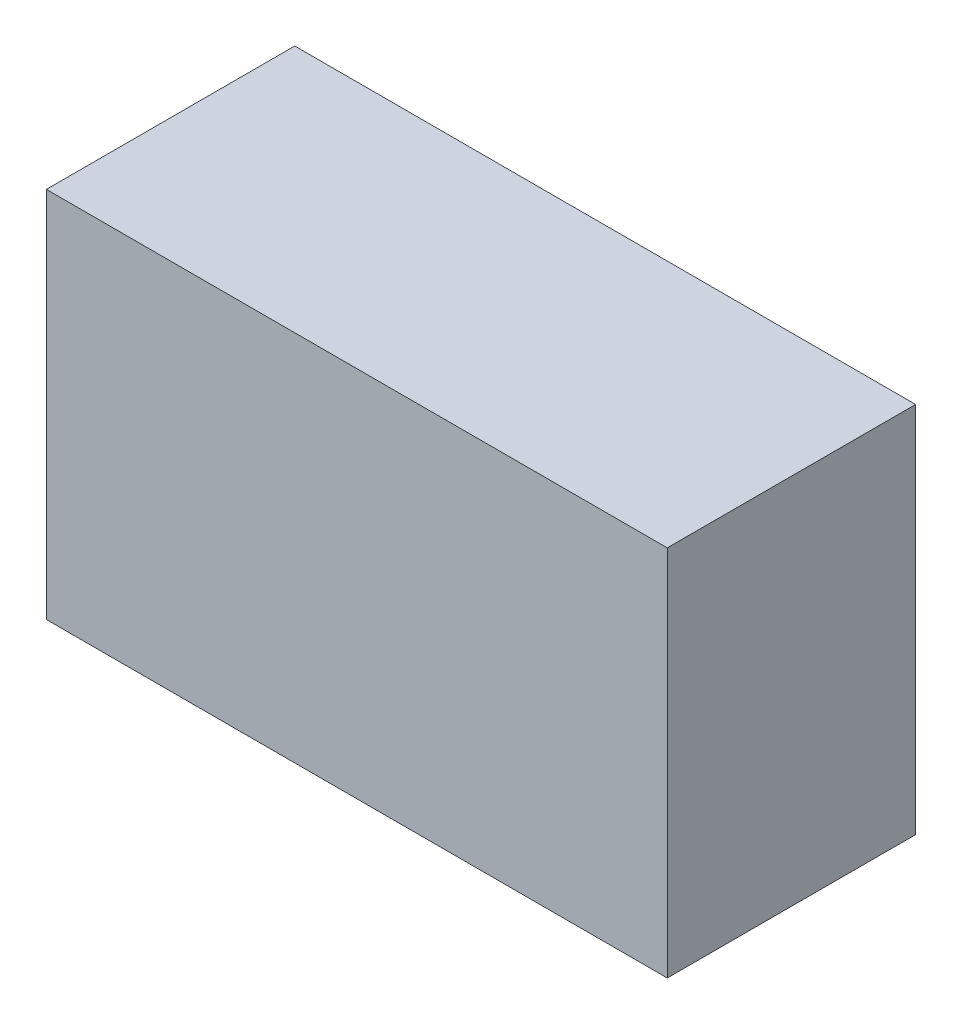
from build123d import *

# Parameters (mm, degrees)
SKETCH_1_W      = 50
SKETCH_1_H      = 30
EXTRUDE_1_DEPTH = 20


with BuildPart() as part:
    # 草图1 → 凸台-拉伸1 (new body)
    with BuildSketch(Plane.XY):
        Rectangle(SKETCH_1_W, SKETCH_1_H)
    extrude(amount=EXTRUDE_1_DEPTH)


solid = part.part
